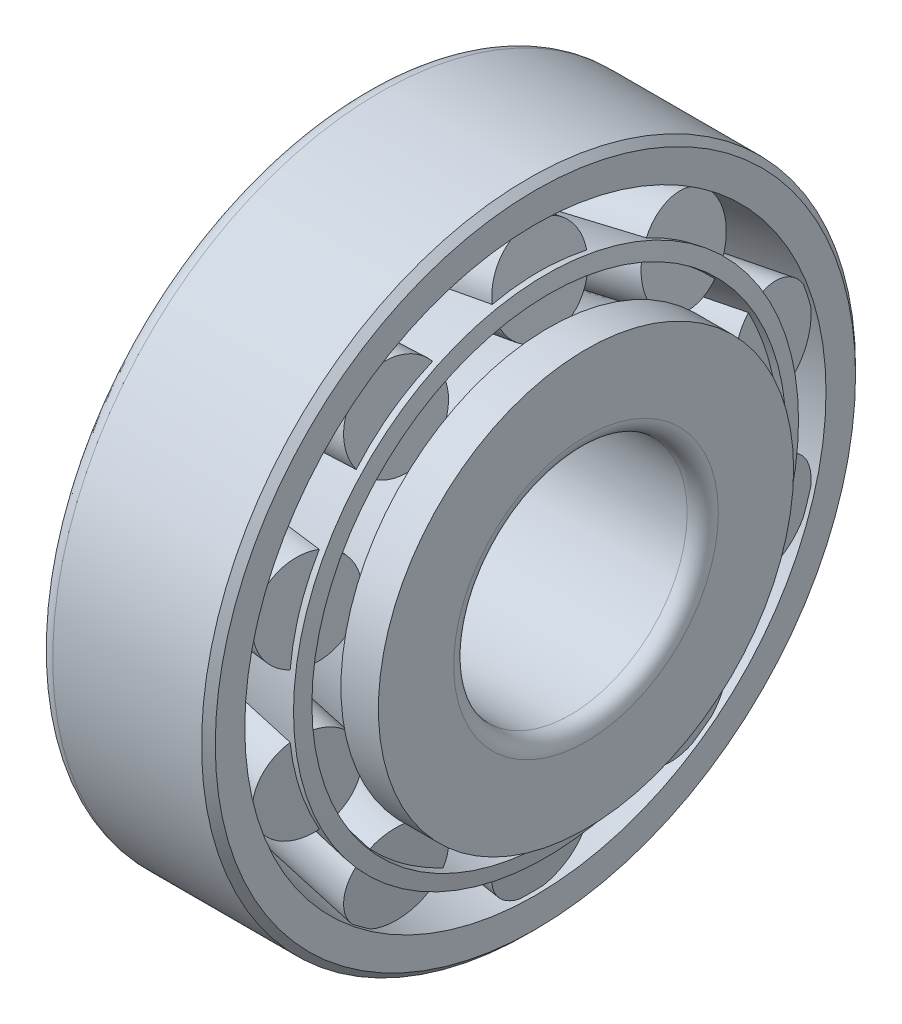
from build123d import *
from build123d.topology import SkipClean

# Parameters (mm, degrees)
ROLLERSDETAILED_COUNT = 10
ROLLERSDETAILED_ANGLE = 324


with BuildPart() as part:
    # OutRacSke → OuterRace (revolve)
    with BuildSketch(Plane.XY, mode=Mode.PRIVATE) as outerrace_sk:
        with BuildLine():
            Line((-3.25, 18.664802045), (-14.25, 16.636))
            Line((-14.25, 16.636), (-14.25, 20))
            ThreePointArc((-14.25, 20), (-13.957106781, 20.707106781), (-13.25, 21))
            Line((-13.25, 21), (-3.69, 21))
            Line((-3.69, 21), (-3.25, 20.56))
            Line((-3.25, 20.56), (-3.25, 18.664802045))
        make_face()
    revolve(outerrace_sk.sketch.rotate(Axis((-42.5, 0, 0), (1, 0, 0)), 270), axis=Axis((-42.5, 0, 0), (1, 0, 0)))

    # RolDetSke → RollerDetailed (revolve)
    with BuildSketch(Plane.XY):
        Polygon((-12.699066134, 13.917420032), (-13.25, 16.904538732), (-3.51420572, 18.700175036), (-2.963271854, 15.713056336), align=None)
    rollerdetailed = revolve(axis=Axis((-41.133127598, 8.673139847, 0), (0.9834135636447758, 0.18137740443473765, 0)))

    # RollersDetailed: RollerDetailed ×10 about axis
    rollersdetailed_axis = Axis((-50, 0, 0), (1, 0, 0))
    for i in range(1, ROLLERSDETAILED_COUNT):
        add(rollerdetailed.rotate(rollersdetailed_axis, i * ROLLERSDETAILED_ANGLE / (ROLLERSDETAILED_COUNT - 1)))

    # InsRacSke → InnerRace (revolve)
    with BuildSketch(Plane.XY, mode=Mode.PRIVATE) as innerrace_sk:
        with BuildLine():
            Line((-12.198645533, 11.234051333), (-13, 11.234051333))
            Line((-13, 11.234051333), (-13, 7.94))
            Line((-13, 7.94), (-12.56, 7.5))
            Line((-12.56, 7.5), (-1, 7.5))
            ThreePointArc((-1, 7.5), (-0.292893219, 7.792893219), (0, 8.5))
            Line((0, 8.5), (0, 13.333437637))
            Line((0, 13.333437637), (-2.406828651, 13.333437637))
            Line((-2.406828651, 13.333437637), (-2.406828651, 12.725937637))
            Line((-2.406828651, 12.725937637), (-12.142622931, 10.930301333))
            Line((-12.142622931, 10.930301333), (-12.198645533, 11.234051333))
        make_face()
    revolve(innerrace_sk.sketch.rotate(Axis((-42.5, 0, 0), (1, 0, 0)), 263.878392469), axis=Axis((-42.5, 0, 0), (1, 0, 0)))

    # CagSpiSke → CageSpine (revolve)
    with SkipClean():  # the faces are left unmerged after this step: merging them gives an invalid solid
        with BuildSketch(Plane.XY, mode=Mode.PRIVATE) as cagespine_sk:
            with BuildLine():
                Line((-2.568304452, 16.216589085), (-12.790888446, 14.331170966))
                ThreePointArc((-12.790888446, 14.331170966), (-13.376142574, 13.951828201), (-13.521743896, 13.269755197))
                Line((-13.521743896, 13.269755197), (-13.374828198, 12.47319021))
                Line((-13.374828198, 12.47319021), (-12.379121965, 12.656834832))
                Line((-12.379121965, 12.656834832), (-12.5076732, 13.353829195))
                Line((-12.5076732, 13.353829195), (-2.38465983, 15.220882852))
                Line((-2.38465983, 15.220882852), (-2.568304452, 16.216589085))
            make_face()
        revolve(cagespine_sk.sketch.rotate(Axis((-42.5, 0, 0), (1, 0, 0)), 263.878392469), axis=Axis((-42.5, 0, 0), (1, 0, 0)))


solid = part.part
